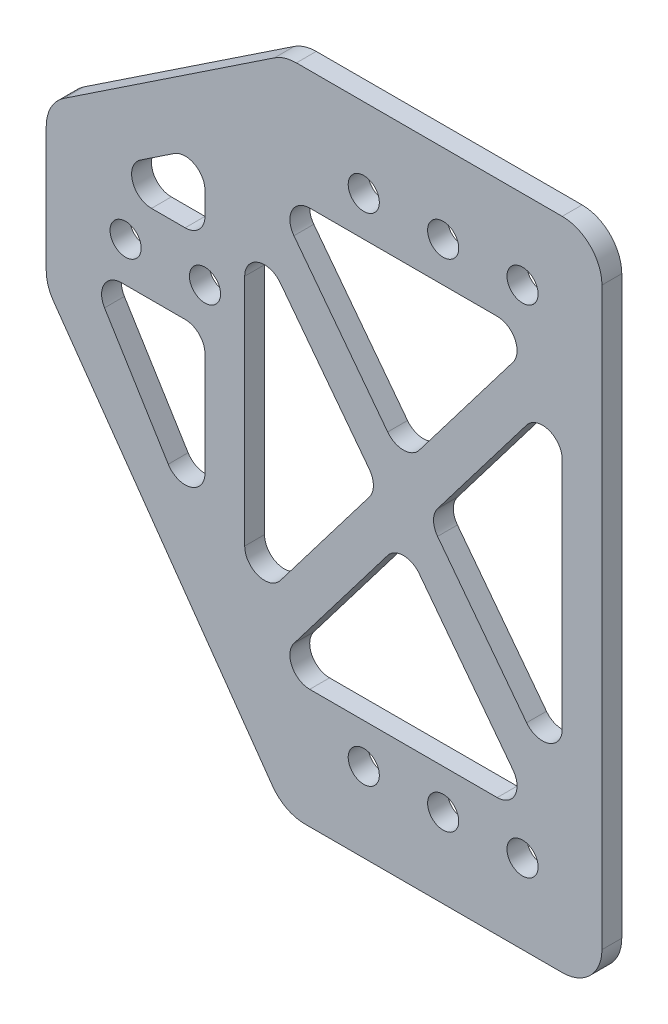
from build123d import *

# Parameters (mm, degrees)
SKETCH1_R           = 2.4892
BOSS_EXTRUDE1_DEPTH = 3.175
FILLET1_R           = 6.35
CUT_EXTRUDE1_DEPTH  = 105.050907012
FILLET3_R           = 3.175


with BuildPart() as part:
    # Sketch1 → Boss-Extrude1 (new body)
    with BuildSketch(Plane.XY):
        Polygon((0, 25.4), (38.1, 50.8), (88.9, 50.8), (88.9, -53.975), (38.1, -53.975), (0, 0), align=None)
        with Locations((12.7, 12.7)):
            Circle(SKETCH1_R, mode=Mode.SUBTRACT)
        with Locations((25.4, 12.7)):
            Circle(SKETCH1_R, mode=Mode.SUBTRACT)
        with Locations((50.8, 38.1)):
            Circle(SKETCH1_R, mode=Mode.SUBTRACT)
        with Locations((63.5, 38.1)):
            Circle(SKETCH1_R, mode=Mode.SUBTRACT)
        with Locations((76.2, 38.1)):
            Circle(SKETCH1_R, mode=Mode.SUBTRACT)
        with Locations((50.8, -41.275)):
            Circle(SKETCH1_R, mode=Mode.SUBTRACT)
        with Locations((76.2, -41.275)):
            Circle(SKETCH1_R, mode=Mode.SUBTRACT)
        with Locations((63.5, -41.275)):
            Circle(SKETCH1_R, mode=Mode.SUBTRACT)
    extrude(amount=BOSS_EXTRUDE1_DEPTH)

    # Fillet1
    fillet1_edges = [part.edges().sort_by_distance(p)[0] for p in [
        (0, 0, 1.5875),
        (0, 25.4, 1.5875),
        (38.1, 50.8, 1.5875),
        (88.9, 50.8, 1.5875),
        (88.9, -53.975, 1.5875),
        (38.1, -53.975, 1.5875),
    ]]
    fillet(fillet1_edges, radius=FILLET1_R)

    # Sketch2 → Cut-Extrude1 (cut, through all)
    with BuildSketch(Plane.XY):
        Polygon((25.4, -24.60625), (25.4, 6.35), (6.35, 6.35), align=None)
        Polygon((53.158456892, -1.5875), (31.75, 26.511099671), (31.75, 6.35), (31.75, -29.686099671), align=None)
        Polygon((78.558456892, -34.925), (57.15, -6.826400329), (35.741543108, -34.925), align=None)
        Polygon((82.55, 26.511099671), (61.141543108, -1.5875), (82.55, -29.686099671), align=None)
        Polygon((35.741543108, 31.75), (57.15, 3.651400329), (78.558456892, 31.75), align=None)
        Polygon((6.35, 19.05), (25.4, 19.05), (25.4, 31.75), align=None)
    extrude(amount=CUT_EXTRUDE1_DEPTH, mode=Mode.SUBTRACT)

    # Fillet3
    fillet3_edges = [part.edges().sort_by_distance(p)[0] for p in [
        (25.4, 31.75, 1.5875),
        (6.35, 19.05, 1.5875),
        (25.4, 19.05, 1.5875),
        (57.15, -6.826400329, 1.5875),
        (35.741543108, -34.925, 1.5875),
        (78.558456892, -34.925, 1.5875),
        (53.158456892, -1.5875, 1.5875),
        (31.75, 26.511099671, 1.5875),
        (31.75, -29.686099671, 1.5875),
        (78.558456892, 31.75, 1.5875),
        (35.741543108, 31.75, 1.5875),
        (57.15, 3.651400329, 1.5875),
        (82.55, -29.686099671, 1.5875),
        (82.55, 26.511099671, 1.5875),
        (61.141543108, -1.5875, 1.5875),
        (25.4, -24.60625, 1.5875),
        (25.4, 6.35, 1.5875),
        (6.35, 6.35, 1.5875),
    ]]
    fillet(fillet3_edges, radius=FILLET3_R)


solid = part.part
